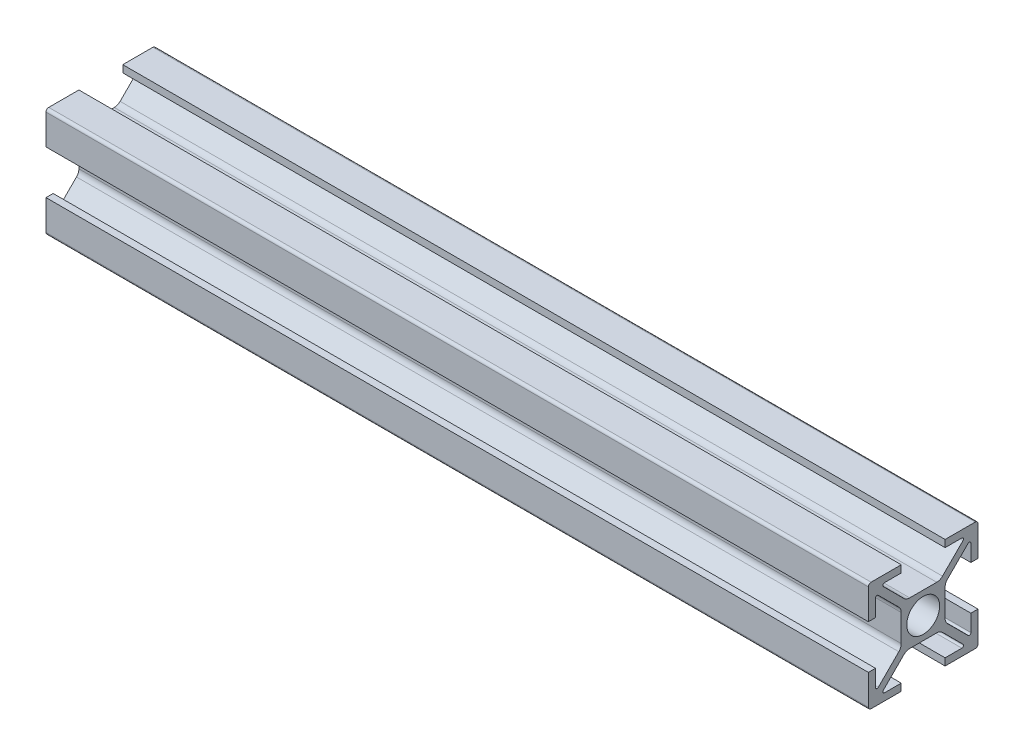
from build123d import *

# Parameters (mm, degrees)
SKETCH1_R                                   = 3
QUADRADO_PF20_01_PERFIL_2020_B_SICO_1_DEPTH = 150


with BuildPart() as part:
    # Sketch1 → Quadrado PF20-01 - PERFIL 2020 BÁSICO(1) (new body)
    with BuildSketch(Plane.YZ):
        with BuildLine():
            Line((8.187867966, -7.26862915), (4.439339828, -3.520101013))
            ThreePointArc((4.439339828, -3.520101013), (4.114180701, -3.033465989), (4, -2.459440841))
            Line((4, -2.459440841), (4, 2.459440841))
            ThreePointArc((4, 2.459440841), (4.114180701, 3.033465989), (4.439339828, 3.520101013))
            Line((4.439339828, 3.520101013), (8.187867966, 7.26862915))
            ThreePointArc((8.187867966, 7.26862915), (8.51480503, 7.333660975), (8.7, 7.056497116))
            Line((8.7, 7.056497116), (8.7, 4))
            Line((8.7, 4), (10, 4))
            Line((10, 4), (10, 9.5))
            ThreePointArc((10, 9.5), (9.853553391, 9.853553391), (9.5, 10))
            Line((9.5, 10), (4, 10))
            Line((4, 10), (4, 8.7))
            Line((4, 8.7), (7.056497116, 8.7))
            ThreePointArc((7.056497116, 8.7), (7.333660975, 8.51480503), (7.26862915, 8.187867966))
            Line((7.26862915, 8.187867966), (3.520101013, 4.439339828))
            ThreePointArc((3.520101013, 4.439339828), (3.033465989, 4.114180701), (2.459440841, 4))
            Line((2.459440841, 4), (-2.459440841, 4))
            ThreePointArc((-2.459440841, 4), (-3.033465989, 4.114180701), (-3.520101013, 4.439339828))
            Line((-3.520101013, 4.439339828), (-7.26862915, 8.187867966))
            ThreePointArc((-7.26862915, 8.187867966), (-7.333660975, 8.51480503), (-7.056497116, 8.7))
            Line((-7.056497116, 8.7), (-4, 8.7))
            Line((-4, 8.7), (-4, 10))
            Line((-4, 10), (-9.5, 10))
            ThreePointArc((-9.5, 10), (-9.853553391, 9.853553391), (-10, 9.5))
            Line((-10, 9.5), (-10, 4))
            Line((-10, 4), (-8.7, 4))
            Line((-8.7, 4), (-8.7, 7.056497116))
            ThreePointArc((-8.7, 7.056497116), (-8.51480503, 7.333660975), (-8.187867966, 7.26862915))
            Line((-8.187867966, 7.26862915), (-4.439339828, 3.520101013))
            ThreePointArc((-4.439339828, 3.520101013), (-4.114180701, 3.033465989), (-4, 2.459440841))
            Line((-4, 2.459440841), (-4, -2.459440841))
            ThreePointArc((-4, -2.459440841), (-4.114180701, -3.033465989), (-4.439339828, -3.520101013))
            Line((-4.439339828, -3.520101013), (-8.187867966, -7.26862915))
            ThreePointArc((-8.187867966, -7.26862915), (-8.51480503, -7.333660975), (-8.7, -7.056497116))
            Line((-8.7, -7.056497116), (-8.7, -4))
            Line((-8.7, -4), (-10, -4))
            Line((-10, -4), (-10, -9.5))
            ThreePointArc((-10, -9.5), (-9.853553391, -9.853553391), (-9.5, -10))
            Line((-9.5, -10), (-4, -10))
            Line((-4, -10), (-4, -8.7))
            Line((-4, -8.7), (-7.056497116, -8.7))
            ThreePointArc((-7.056497116, -8.7), (-7.333660975, -8.51480503), (-7.26862915, -8.187867966))
            Line((-7.26862915, -8.187867966), (-3.520101013, -4.439339828))
            ThreePointArc((-3.520101013, -4.439339828), (-3.033465989, -4.114180701), (-2.459440841, -4))
            Line((-2.459440841, -4), (2.459440841, -4))
            ThreePointArc((2.459440841, -4), (3.033465989, -4.114180701), (3.520101013, -4.439339828))
            Line((3.520101013, -4.439339828), (7.26862915, -8.187867966))
            ThreePointArc((7.26862915, -8.187867966), (7.333660975, -8.51480503), (7.056497116, -8.7))
            Line((7.056497116, -8.7), (4, -8.7))
            Line((4, -8.7), (4, -10))
            Line((4, -10), (9.5, -10))
            ThreePointArc((9.5, -10), (9.853553391, -9.853553391), (10, -9.5))
            Line((10, -9.5), (10, -4))
            Line((10, -4), (8.7, -4))
            Line((8.7, -4), (8.7, -7.056497116))
            ThreePointArc((8.7, -7.056497116), (8.51480503, -7.333660975), (8.187867966, -7.26862915))
        make_face()
        Circle(SKETCH1_R, mode=Mode.SUBTRACT)
    extrude(amount=QUADRADO_PF20_01_PERFIL_2020_B_SICO_1_DEPTH)


solid = part.part
